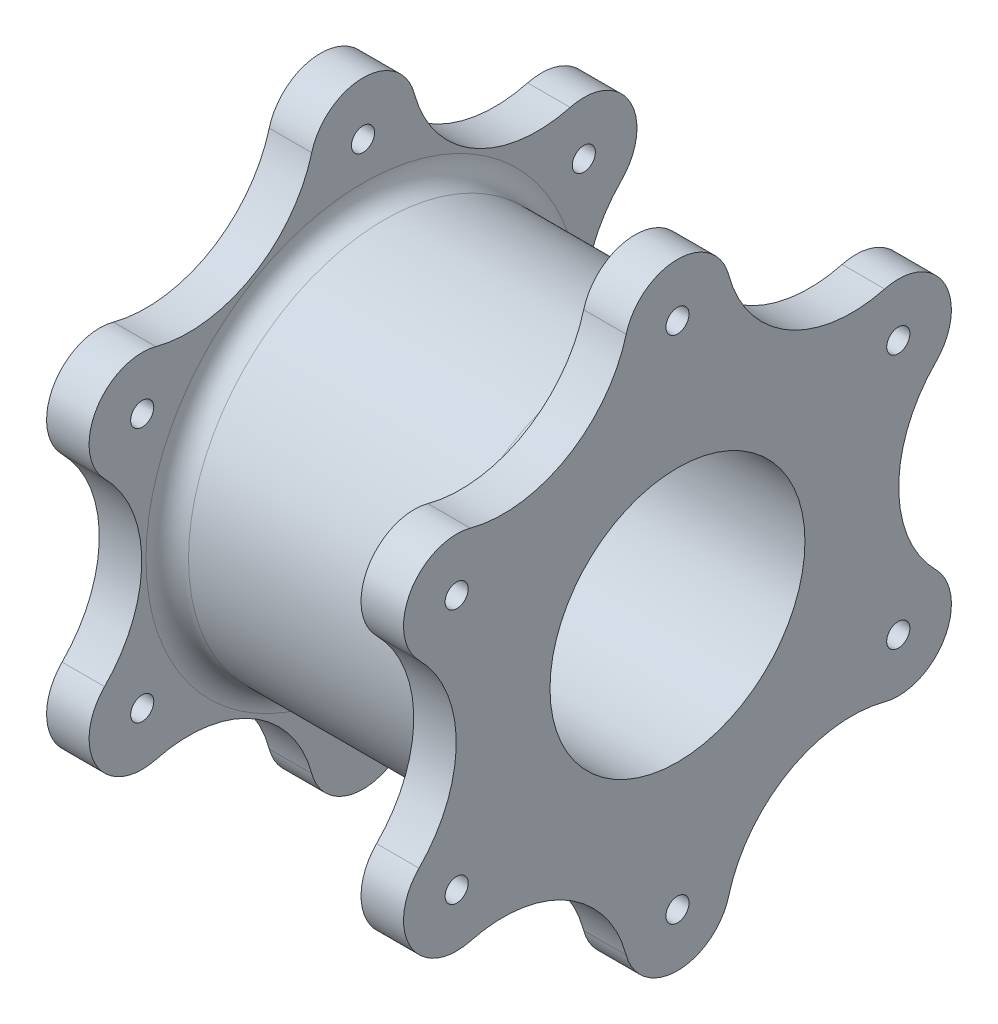
from build123d import *

# Parameters (mm, degrees)
SKETCH1_R           = 1.7272
SKETCH1_R_2         = 19.05
BOSS_EXTRUDE1_DEPTH = 6.35
BOSS_EXTRUDE2_START = 20.32
SKETCH3_R           = 29.251599278
SKETCH3_R_2         = 19.05
BOSS_EXTRUDE2_DEPTH = 20.32
FILLET1_R           = 3.175


with BuildPart() as part:
    # Sketch1 → Boss-Extrude1 (new body)
    with BuildSketch(Plane(origin=(0, 0, 0), x_dir=(0, 0, -1), z_dir=(1, 0, 0))):
        with BuildLine():
            ThreePointArc((30.954459577, 26.720579061), (16.530799639, 28.632184865), (7.663470482, 40.167637884))
            ThreePointArc((7.663470482, 40.167637884), (0, 46.0375), (-7.663470482, 40.167637884))
            ThreePointArc((-7.663470482, 40.167637884), (-16.530799639, 28.632184865), (-30.954459577, 26.720579061))
            ThreePointArc((-30.954459577, 26.720579061), (-39.869644527, 23.01875), (-38.617930059, 13.447058824))
            ThreePointArc((-38.617930059, 13.447058824), (-33.061599278, 0), (-38.617930059, -13.447058824))
            ThreePointArc((-38.617930059, -13.447058824), (-39.869644527, -23.01875), (-30.954459577, -26.720579061))
            ThreePointArc((-30.954459577, -26.720579061), (-16.530799639, -28.632184865), (-7.663470482, -40.167637884))
            ThreePointArc((-7.663470482, -40.167637884), (0, -46.0375), (7.663470482, -40.167637884))
            ThreePointArc((7.663470482, -40.167637884), (16.530799639, -28.632184865), (30.954459577, -26.720579061))
            ThreePointArc((30.954459577, -26.720579061), (39.869644527, -23.01875), (38.617930059, -13.447058824))
            ThreePointArc((38.617930059, -13.447058824), (33.061599278, 0), (38.617930059, 13.447058824))
            ThreePointArc((38.617930059, 13.447058824), (39.869644527, 23.01875), (30.954459577, 26.720579061))
        make_face()
        with Locations((-32.995567884, -19.05)):
            Circle(SKETCH1_R, mode=Mode.SUBTRACT)
        with Locations((0, -38.1)):
            Circle(SKETCH1_R, mode=Mode.SUBTRACT)
        with Locations((32.995567884, -19.05)):
            Circle(SKETCH1_R, mode=Mode.SUBTRACT)
        with Locations((-32.995567884, 19.05)):
            Circle(SKETCH1_R, mode=Mode.SUBTRACT)
        Circle(SKETCH1_R_2, mode=Mode.SUBTRACT)
        with Locations((32.995567884, 19.05)):
            Circle(SKETCH1_R, mode=Mode.SUBTRACT)
        with Locations((0, 38.1)):
            Circle(SKETCH1_R, mode=Mode.SUBTRACT)
    extrude(amount=BOSS_EXTRUDE1_DEPTH)

    # Sketch3 → Boss-Extrude2 (add)
    with BuildSketch(Plane.ZY.offset(BOSS_EXTRUDE2_START)):
        with Locations(Location((0, 0, 0), (0, 0, 180))):
            Circle(SKETCH3_R)
        with Locations(Location((0, 0, 0), (0, 0, 180))):
            Circle(SKETCH3_R_2, mode=Mode.SUBTRACT)
    extrude(amount=-BOSS_EXTRUDE2_DEPTH)

    # Fillet1
    fillet1_edges = [part.edges().sort_by_distance(p)[0] for p in [
        (0, 0, 29.251599278),
    ]]
    fillet(fillet1_edges, radius=FILLET1_R)

    # Mirror4: part across plane


with BuildPart() as part_1:
    add(part.part)
    add(part.part.mirror(Plane(origin=(-20.32, 0, 0), x_dir=(0, 0, 1), z_dir=(1, 0, 0))))


solid = part_1.part
